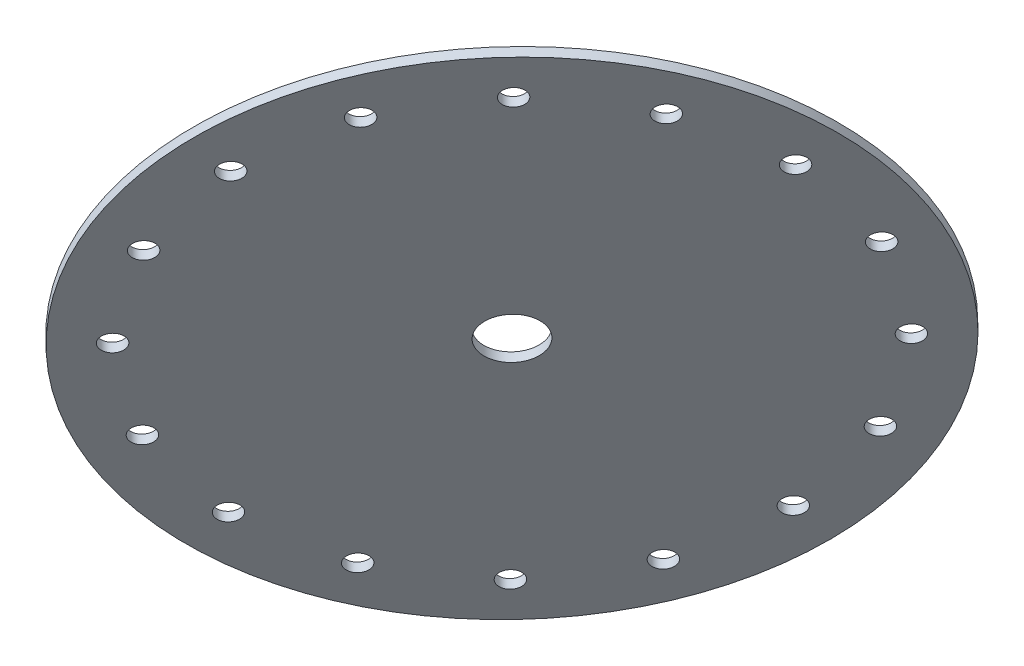
from build123d import *

# Parameters (mm, degrees)
SKETCH2_R           = 175
SKETCH2_R_2         = 15
SKETCH2_R_3         = 6.1
BOSS_EXTRUDE1_DEPTH = 5


with BuildPart() as part:
    # Sketch2 → Boss-Extrude1 (new body)
    with BuildSketch(Plane(origin=(-290.961013368, 128.346984984, -280.401913549), x_dir=(0.6169187616524279, -0.2394039589976409, -0.7497312758165361), z_dir=(0.6862660385896976, -0.3027215774715836, 0.6613611500621426))):
        with Locations(Location((0, 0, 0), (0, 0, 14.547943675))):
            Circle(SKETCH2_R)
        with Locations(Location((0, 0, 0), (0, 0, 14.547943675))):
            Circle(SKETCH2_R_2, mode=Mode.SUBTRACT)
        with Locations(Location((-75.811902912, -129.431662961, 0), (0, 0, 14.547943675))):
            Circle(SKETCH2_R_3, mode=Mode.SUBTRACT)
        with Locations(Location((-119.57241846, -90.567305048, 0), (0, 0, 14.547943675))):
            Circle(SKETCH2_R_3, mode=Mode.SUBTRACT)
        with Locations(Location((-145.129117224, -37.914895936, 0), (0, 0, 14.547943675))):
            Circle(SKETCH2_R_3, mode=Mode.SUBTRACT)
        with Locations(Location((-148.591223489, 20.509712382, 0), (0, 0, 14.547943675))):
            Circle(SKETCH2_R_3, mode=Mode.SUBTRACT)
        with Locations(Location((-129.431662961, 75.811902912, 0), (0, 0, 14.547943675))):
            Circle(SKETCH2_R_3, mode=Mode.SUBTRACT)
        with Locations(Location((-90.567305048, 119.57241846, 0), (0, 0, 14.547943675))):
            Circle(SKETCH2_R_3, mode=Mode.SUBTRACT)
        with Locations(Location((-37.914895936, 145.129117224, 0), (0, 0, 14.547943675))):
            Circle(SKETCH2_R_3, mode=Mode.SUBTRACT)
        with Locations(Location((20.509712382, 148.591223489, 0), (0, 0, 14.547943675))):
            Circle(SKETCH2_R_3, mode=Mode.SUBTRACT)
        with Locations(Location((75.811902912, 129.431662961, 0), (0, 0, 14.547943675))):
            Circle(SKETCH2_R_3, mode=Mode.SUBTRACT)
        with Locations(Location((119.57241846, 90.567305048, 0), (0, 0, 14.547943675))):
            Circle(SKETCH2_R_3, mode=Mode.SUBTRACT)
        with Locations(Location((145.129117224, 37.914895936, 0), (0, 0, 14.547943675))):
            Circle(SKETCH2_R_3, mode=Mode.SUBTRACT)
        with Locations(Location((148.591223489, -20.509712382, 0), (0, 0, 14.547943675))):
            Circle(SKETCH2_R_3, mode=Mode.SUBTRACT)
        with Locations(Location((129.431662961, -75.811902912, 0), (0, 0, 14.547943675))):
            Circle(SKETCH2_R_3, mode=Mode.SUBTRACT)
        with Locations(Location((90.567305048, -119.57241846, 0), (0, 0, 14.547943675))):
            Circle(SKETCH2_R_3, mode=Mode.SUBTRACT)
        with Locations(Location((37.914895936, -145.129117224, 0), (0, 0, 14.547943675))):
            Circle(SKETCH2_R_3, mode=Mode.SUBTRACT)
        with Locations(Location((-20.509712382, -148.591223489, 0), (0, 0, 14.547943675))):
            Circle(SKETCH2_R_3, mode=Mode.SUBTRACT)
    extrude(amount=BOSS_EXTRUDE1_DEPTH)


solid = part.part
